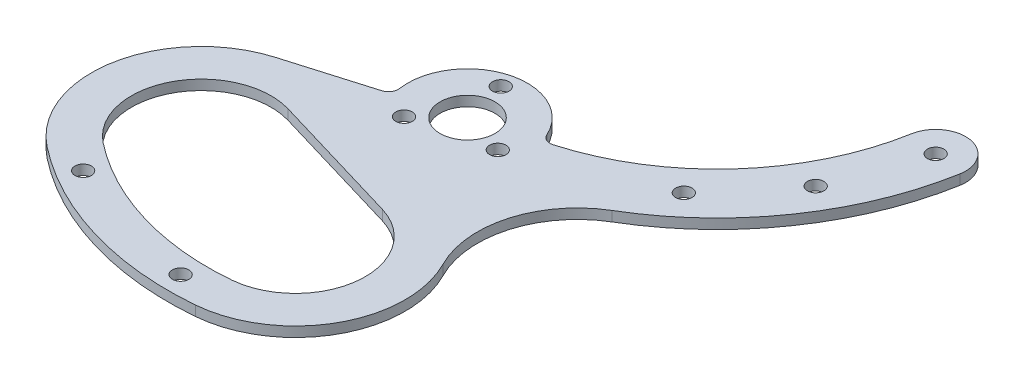
from build123d import *

# Parameters (mm, degrees)
SKETCH_1_R         = 1.65
SKETCH_1_R_2       = 5.5
EXTRUDE_4604_DEPTH = 2
FILLET_1_R         = 2


with BuildPart() as part:
    # Эскиз1 → Extrude 4604 (new body)
    with BuildSketch(Plane(origin=(0, 0, 0), x_dir=(1, 0, 0), z_dir=(0, 1, 0))):
        with BuildLine():
            Line((-11.508257905, -3.4), (-29.714194139, -8.778762251))
            ThreePointArc((-29.714194139, -8.778762251), (-45.087395339, -25.73505383), (-37.075043377, -47.1745817))
            ThreePointArc((-37.075043377, -47.1745817), (-17.087040134, -57.515502775), (5.304800773, -59.765032325))
            ThreePointArc((5.304800773, -59.765032325), (22.603580264, -48.512957528), (22.97025793, -27.879913482))
            ThreePointArc((22.97025793, -27.879913482), (21.591479888, -13.237630517), (30.59852352, -1.611339436))
            ThreePointArc((30.59852352, -1.611339436), (49.34717261, 15.870005048), (59.088465181, 39.58110934))
            ThreePointArc((59.088465181, 39.58110934), (54.221507729, 46.531844924), (47.270772145, 41.664887472))
            ThreePointArc((47.270772145, 41.664887472), (35.068418794, 17.224917951), (11.508257905, 3.4))
            ThreePointArc((11.508257905, 3.4), (-3.4, 11.508257905), (-11.508257905, -3.4))
        make_face()
        with Locations(Location((-1.510792129, -55.97961689, 0), (0, 0, 90))):
            Circle(SKETCH_1_R, mode=Mode.SUBTRACT)
        with Locations(Location((-29.298192809, -47.724374256, 0), (0, 0, 270))):
            Circle(SKETCH_1_R, mode=Mode.SUBTRACT)
        with Locations(Location((0, 0, 0), (0, 0, 270))):
            Circle(SKETCH_1_R_2, mode=Mode.SUBTRACT)
        with Locations(Location((8.627325416, -2.56305602, 0), (0, 0, 270))):
            Circle(SKETCH_1_R, mode=Mode.SUBTRACT)
        with Locations(Location((-6.533334333, -6.189954967, 0), (0, 0, 270))):
            Circle(SKETCH_1_R, mode=Mode.SUBTRACT)
        with Locations(Location((-2.093991083, 8.753010987, 0), (0, 0, 270))):
            Circle(SKETCH_1_R, mode=Mode.SUBTRACT)
        with Locations(Location((53.179618663, 40.622998406, 0), (0, 0, 270))):
            Circle(SKETCH_1_R, mode=Mode.SUBTRACT)
        with Locations(Location((46.765371804, 23, 0), (0, 0, 270))):
            Circle(SKETCH_1_R, mode=Mode.SUBTRACT)
        with Locations(Location((34.710530923, 8.633600072, 0), (0, 0, 270))):
            Circle(SKETCH_1_R, mode=Mode.SUBTRACT)
        with BuildLine():
            Line((-19.493884775, -16.456951096), (7.346683187, -24.430903158))
            ThreePointArc((7.346683187, -24.430903158), (17.289589147, -39.25061121), (4.597494003, -51.796361348))
            ThreePointArc((4.597494003, -51.796361348), (-14.808768116, -49.846769072), (-32.13170426, -40.884637473))
            ThreePointArc((-32.13170426, -40.884637473), (-35.915324215, -23.444186054), (-19.493884775, -16.456951096))
        make_face(mode=Mode.SUBTRACT)
    extrude(amount=EXTRUDE_4604_DEPTH)

    # Скругление1
    fillet_1_edges = [part.edges().sort_by_distance(p)[0] for p in [
        (-11.508257905, 1, 3.4),
        (11.508257905, 1, -3.4),
    ]]
    fillet(fillet_1_edges, radius=FILLET_1_R)


solid = part.part
